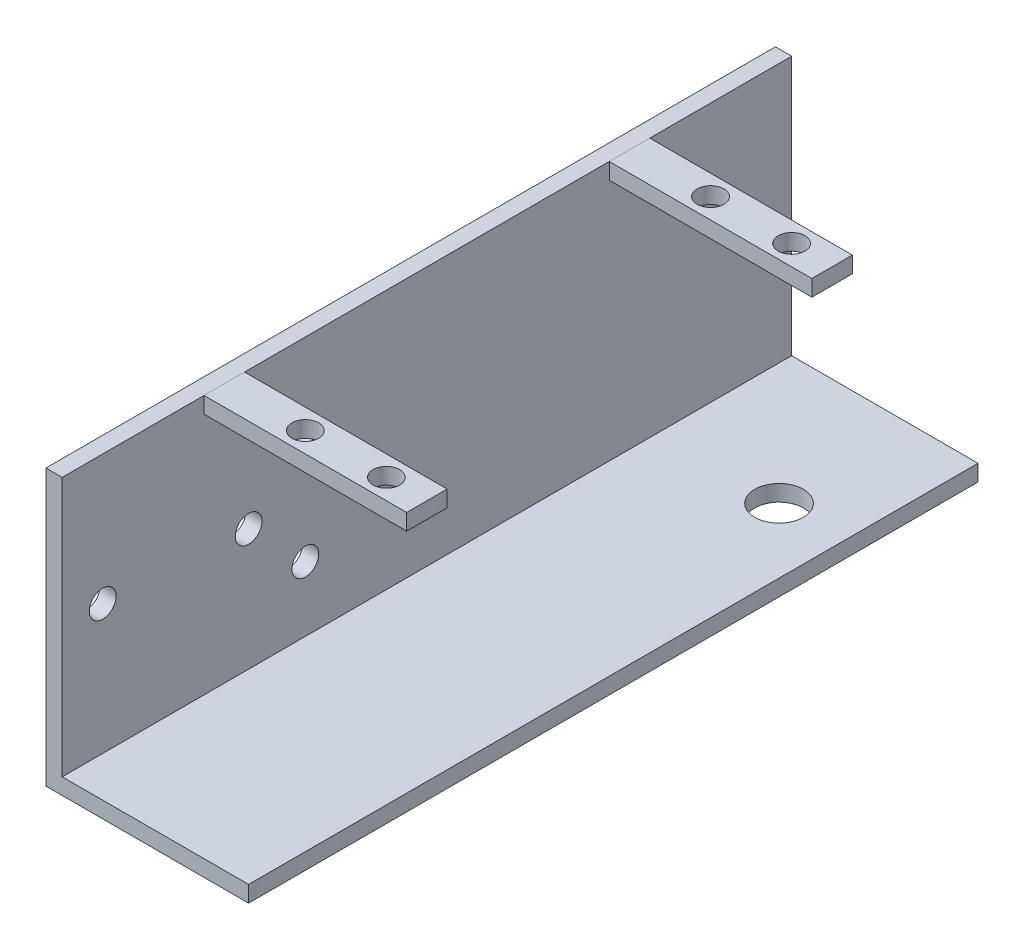
from build123d import *

# Parameters (mm, degrees)
SKETCH_1_W          = 25
SKETCH_1_H          = 90
EXTRUDE_1_DEPTH     = 2
SKETCH_3_W          = 2
SKETCH_3_H          = 90
EXTRUDE_2_DEPTH     = 32
SKETCH_4_W          = 5
SKETCH_4_H          = 2
EXTRUDE_3_DEPTH     = 25
EXTRUDE_3_2_DEPTH   = 25
SKETCH_5_R          = 1.65
CUT_EXTRUDE_2_DEPTH = 2
SKETCH_6_R          = 1.65
CUT_EXTRUDE_3_DEPTH = 10
SKETCH_7_R          = 3
CUT_EXTRUDE_4_DEPTH = 10
SKETCH_8_R          = 1.65
CUT_EXTRUDE_5_DEPTH = 10


with BuildPart() as part:
    # 草图1 → 凸台-拉伸1 (new body)
    with BuildSketch(Plane(origin=(0, 0, 0), x_dir=(1, 0, 0), z_dir=(0, 1, 0))):
        Rectangle(SKETCH_1_W, SKETCH_1_H)
    extrude(amount=EXTRUDE_1_DEPTH)

    # 草图3 → 凸台-拉伸2 (add)
    with BuildSketch(Plane(origin=(0, 2, 0), x_dir=(1, 0, 0), z_dir=(0, 1, 0))):
        with Locations((-11.5, 0)):
            Rectangle(SKETCH_3_W, SKETCH_3_H)
    extrude(amount=EXTRUDE_2_DEPTH)

    # 草图6 → 切除-拉伸3 (cut)
    with BuildSketch(Plane.ZY.offset(12.5)):
        with Locations((8, 17)):
            Circle(SKETCH_6_R)
        with Locations((22, 17)):
            Circle(SKETCH_6_R)
        with Locations((15, 10)):
            Circle(SKETCH_6_R)
        with Locations((15, 24)):
            Circle(SKETCH_6_R)
    extrude(amount=-CUT_EXTRUDE_3_DEPTH, mode=Mode.SUBTRACT)

    # 草图7 → 切除-拉伸4 (cut)
    with BuildSketch(Plane(origin=(0, 0, 0), x_dir=(-1, 0, 0), z_dir=(0, -1, 0))):
        with Locations(Location((-4.5, 28.45, 0), (0, 0, 90))):
            Circle(SKETCH_7_R)
    extrude(amount=-CUT_EXTRUDE_4_DEPTH, mode=Mode.SUBTRACT)

    # 草图8 → 切除-拉伸5 (cut)
    with BuildSketch(Plane(origin=(-10.5, 0, 0), x_dir=(0, 0, -1), z_dir=(1, 0, 0))):
        with Locations((-40, 18)):
            Circle(SKETCH_8_R)
        with Locations((40, 18)):
            Circle(SKETCH_8_R)
    extrude(amount=-CUT_EXTRUDE_5_DEPTH, mode=Mode.SUBTRACT)


with BuildPart() as body_2:
    # 草图4 → 凸台-拉伸3 (new body)
    with BuildSketch(Plane(origin=(-10.5, 0, 0), x_dir=(0, 0, -1), z_dir=(1, 0, 0))):
        with Locations((25, 33)):
            Rectangle(SKETCH_4_W, SKETCH_4_H)
    extrude(amount=EXTRUDE_3_DEPTH)


with BuildPart() as body_3:
    # 草图4 → Extrude 3 2 (new body)
    with BuildSketch(Plane(origin=(-10.5, 0, 0), x_dir=(0, 0, -1), z_dir=(1, 0, 0))):
        with Locations((-25, 33)):
            Rectangle(SKETCH_4_W, SKETCH_4_H)
    extrude(amount=EXTRUDE_3_2_DEPTH)


with BuildPart() as cut_extrude_2_tool:
    # 草图5 → 切除-拉伸2 (new body)
    with BuildSketch(Plane(origin=(0, 34, 0), x_dir=(1, 0, 0), z_dir=(0, 1, 0))):
        with Locations(Location((-0.5, -25, 0), (0, 0, 270))):
            Circle(SKETCH_5_R)
        with Locations(Location((9.5, -25, 0), (0, 0, 270))):
            Circle(SKETCH_5_R)
        with Locations(Location((9.5, 25, 0), (0, 0, 270))):
            Circle(SKETCH_5_R)
        with Locations(Location((-0.5, 25, 0), (0, 0, 270))):
            Circle(SKETCH_5_R)
    extrude(amount=-CUT_EXTRUDE_2_DEPTH)


with BuildPart() as body_2_1:
    add(body_2.part)

    # 切除-拉伸2: cut by cut_extrude_2_tool
    add(cut_extrude_2_tool.part, mode=Mode.SUBTRACT)


with BuildPart() as body_3_1:
    add(body_3.part)

    # 切除-拉伸2: cut by cut_extrude_2_tool
    add(cut_extrude_2_tool.part, mode=Mode.SUBTRACT)


solid = Compound([part.part, body_2_1.part, body_3_1.part])
